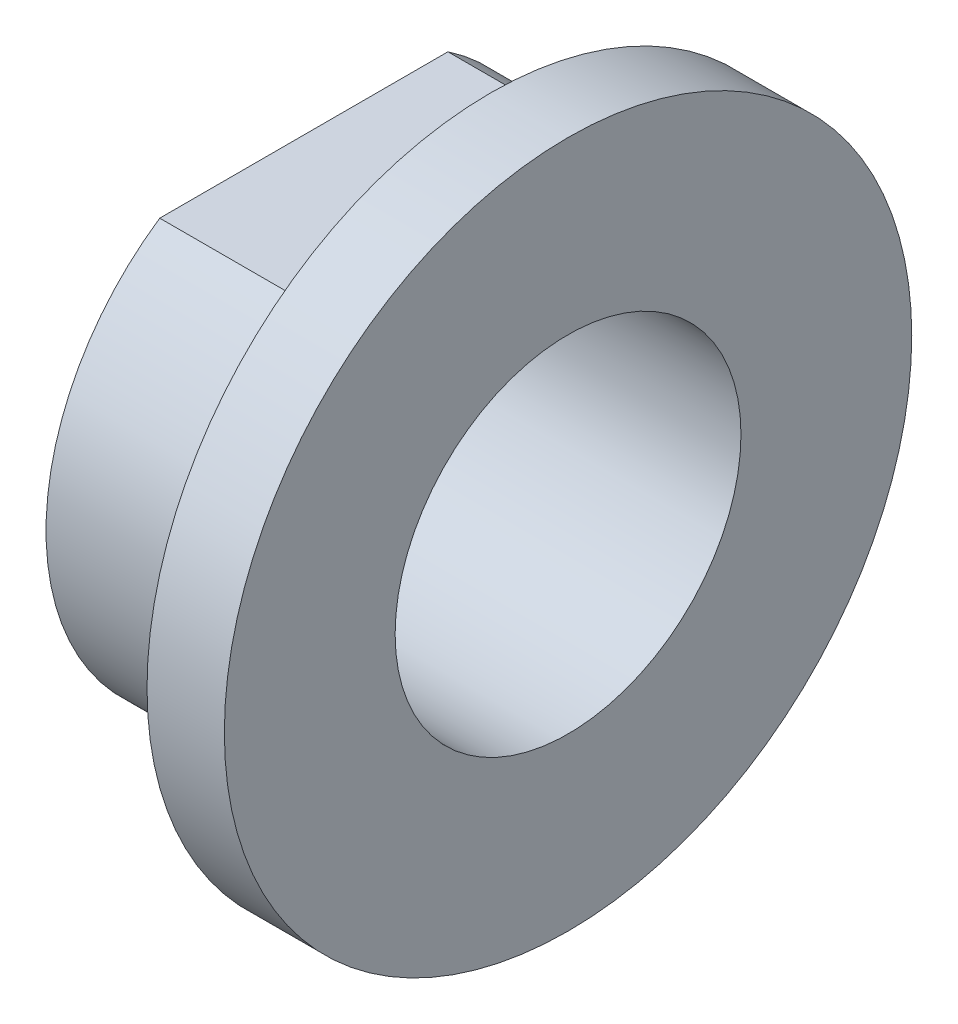
from build123d import *

# Parameters (mm, degrees)
CORTAR_EXTRUIR1_DEPTH = 4.35


with BuildPart() as part:
    # Croquis1 → Revolución1 (revolve)
    with BuildSketch(Plane(origin=(0, 0, 0), x_dir=(0, 1, 0), z_dir=(0, 0, 1)), mode=Mode.PRIVATE) as revoluci_n1_sk:
        Polygon((4.025, 6.15), (4.025, 0), (8, 0), (8, 1.8), (6, 1.8), (6, 6.15), align=None)
    revolve(revoluci_n1_sk.sketch.rotate(Axis((0, 0, 0), (-1, 0, 0)), 90), axis=Axis((0, 0, 0), (-1, 0, 0)))

    # Croquis2 → Cortar-Extruir1 (cut)
    with BuildSketch(Plane(origin=(-6.15, 0, 0), x_dir=(0, -1, 0), z_dir=(-1, 0, 0))):
        with BuildLine():
            Line((-4.975, 3.354008795), (-4.975, -3.354008795))
            ThreePointArc((-4.975, -3.354008795), (-6, 0), (-4.975, 3.354008795))
        make_face()
        with BuildLine():
            Line((4.975, 3.354008795), (4.975, -3.354008795))
            ThreePointArc((4.975, -3.354008795), (6, 0), (4.975, 3.354008795))
        make_face()
    extrude(amount=-CORTAR_EXTRUIR1_DEPTH, mode=Mode.SUBTRACT)


solid = part.part
